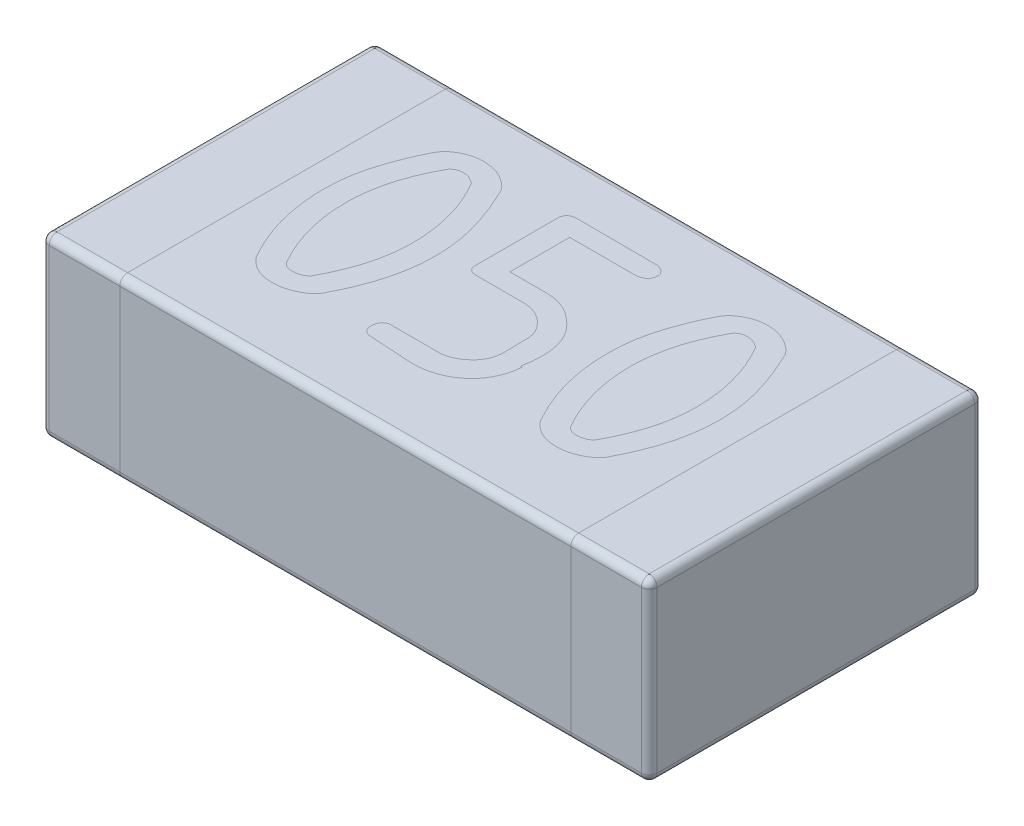
from build123d import *

# Parameters (mm, degrees)
BOSS_EXTRUDE1_DEPTH = 0.225
FILLET2_R           = 0.02


with BuildPart() as part:
    # Sketch1 → Boss-Extrude1 (new, symmetric)
    with BuildSketch(Plane(origin=(0, 0, 0), x_dir=(1, 0, 0), z_dir=(0, 1, 0))):
        with BuildLine():
            Line((-0.755, -0.425), (0.755, -0.425))
            ThreePointArc((0.755, -0.425), (0.769142136, -0.419142136), (0.775, -0.405))
            Line((0.775, -0.405), (0.775, 0.405))
            ThreePointArc((0.775, 0.405), (0.769142136, 0.419142136), (0.755, 0.425))
            Line((0.755, 0.425), (-0.755, 0.425))
            ThreePointArc((-0.755, 0.425), (-0.769142136, 0.419142136), (-0.775, 0.405))
            Line((-0.775, 0.405), (-0.775, -0.405))
            ThreePointArc((-0.775, -0.405), (-0.769142136, -0.419142136), (-0.755, -0.425))
        make_face()
    extrude(amount=BOSS_EXTRUDE1_DEPTH, both=True)

    # Fillet2
    fillet2_edges = [part.edges().sort_by_distance(p)[0] for p in [
        (0.769142136, 0.225, 0.419142136),
        (0, -0.225, 0.425),
        (-0.769142136, -0.225, 0.419142136),
        (0, -0.225, 0.425),
        (0, -0.225, 0.425),
        (0, -0.225, -0.425),
        (0, -0.225, -0.425),
        (0.775, 0.225, 0),
        (0.769142136, 0.225, -0.419142136),
        (0, 0.225, -0.425),
        (-0.769142136, 0.225, -0.419142136),
        (-0.775, 0.225, 0),
        (-0.769142136, 0.225, 0.419142136),
        (0, 0.225, 0.425),
        (-0.775, -0.225, 0),
        (-0.769142136, -0.225, -0.419142136),
        (0, 0.225, 0.425),
        (0, 0.225, -0.425),
        (0, -0.225, -0.425),
        (0.769142136, -0.225, -0.419142136),
        (0, 0.225, -0.425),
        (0, 0.225, 0.425),
        (0.775, -0.225, 0),
        (0.769142136, -0.225, 0.419142136),
    ]]
    fillet(fillet2_edges, radius=FILLET2_R)


solid = part.part
